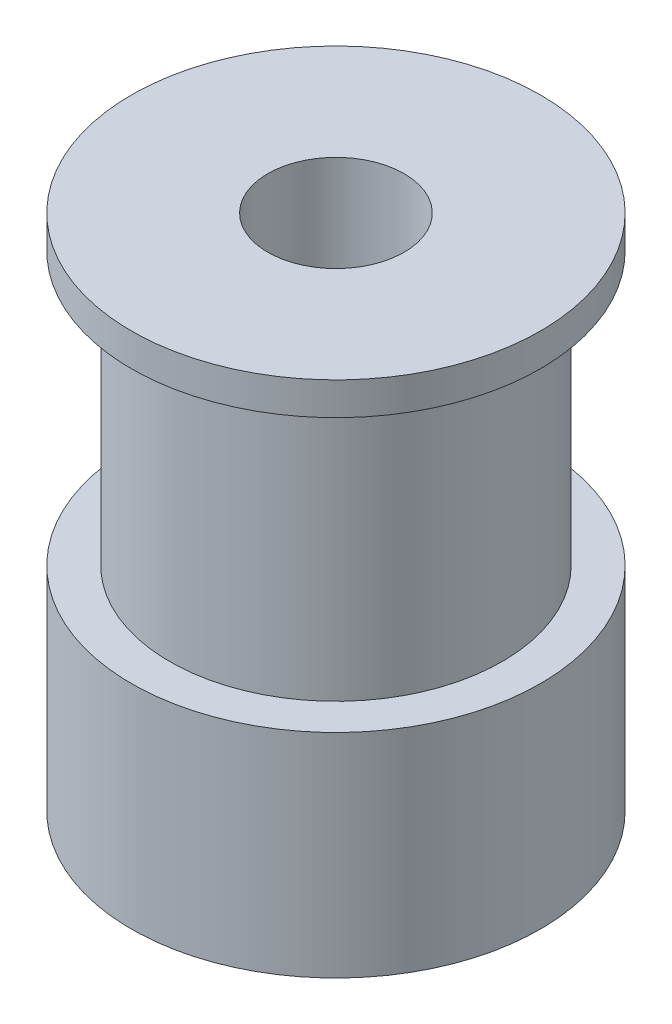
from build123d import *


with BuildPart() as part:
    # Sketch1 → Revolve1 (revolve)
    with BuildSketch(Plane.XY, mode=Mode.PRIVATE) as revolve1_sk:
        Polygon((-2.5, 0), (-2.5, 19), (-7.5, 19), (-7.5, 17.8), (-6.1, 17.8), (-6.1, 7.8), (-7.5, 7.8), (-7.5, 0), align=None)
    revolve(revolve1_sk.sketch.rotate(Axis((0, 0, 0), (0, 1, 0)), 270), axis=Axis((0, 0, 0), (0, 1, 0)))


solid = part.part
